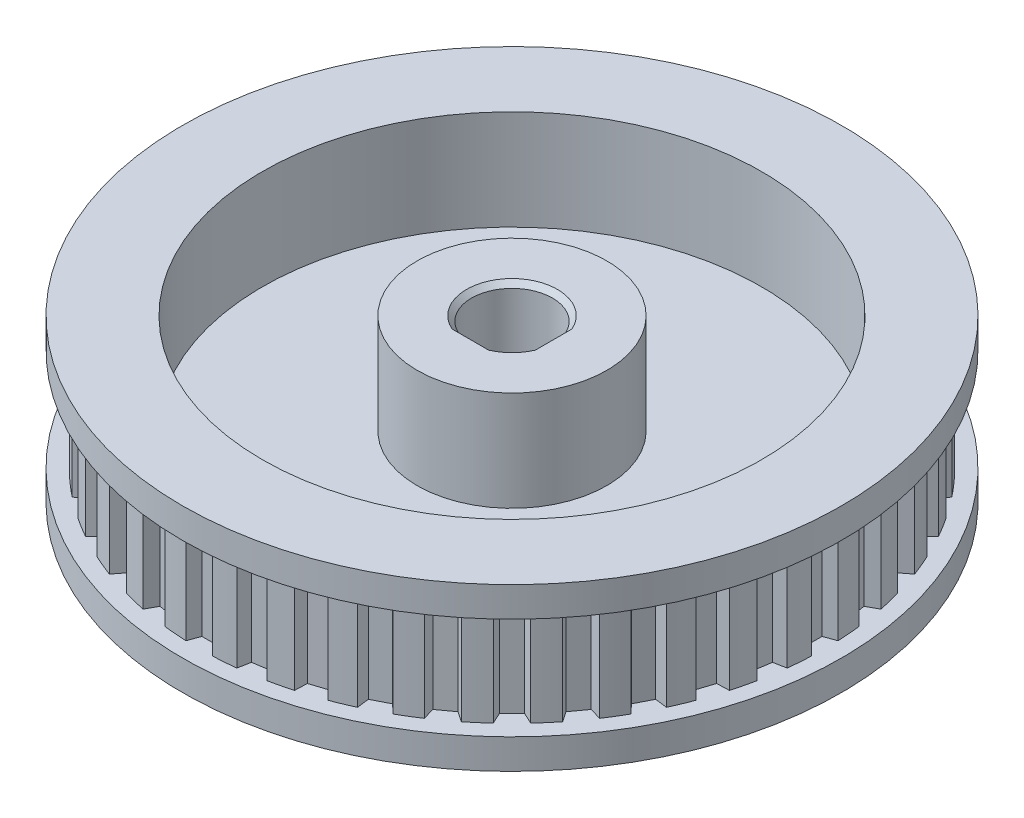
from build123d import *
from build123d.topology import SkipClean

# Parameters (mm, degrees)
EXTRUDE_1_DEPTH     = 10.2
SKETCH_2_R          = 33
EXTRUDE_2_DEPTH     = 3
EXTRUDE_START       = 3
SKETCH_3_R          = 33
EXTRUDE_3_DEPTH     = 3
SKETCH_4_R          = 25
SKETCH_4_R_2        = 9.5
CUT_EXTRUDE_4_DEPTH = 10
CUT_EXTRUDE_5_DEPTH = 10
CUT_EXTRUDE_START   = -6.2
SKETCH_6_R          = 4.05
CUT_EXTRUDE_6_DEPTH = 6.2
CHAMFER_1_SIZE      = 0.5
CHAMFER_2_SIZE      = 0.5


with BuildPart() as part:
    # Эскиз1 → Вытянуть1 (new body)
    with BuildSketch(Plane(origin=(0, 0, 0), x_dir=(1, 0, 0), z_dir=(0, 1, 0))):
        with BuildLine():
            Line((-0.9, 30.15), (0.9, 30.15))
            Line((0.9, 30.15), (1.326544618, 31.321921706))
            ThreePointArc((1.326544618, 31.321921706), (2.459692651, 31.253358413), (3.589615414, 31.143814172))
            Line((3.589615414, 31.143814172), (3.827579614, 29.919594487))
            Line((3.827579614, 29.919594487), (5.605418627, 29.63801245))
            Line((5.605418627, 29.63801245), (6.210040719, 30.728779577))
            ThreePointArc((6.210040719, 30.728779577), (7.318512157, 30.483797004), (8.417387201, 30.198842572))
            Line((8.417387201, 30.198842572), (8.460911516, 28.952469261))
            Line((8.460911516, 28.952469261), (10.172813245, 28.396238671))
            Line((10.172813245, 28.396238671), (10.940625007, 29.378992911))
            ThreePointArc((10.940625007, 29.378992911), (11.997125605, 28.963623344), (13.037894979, 28.510275244))
            Line((13.037894979, 28.510275244), (12.885907695, 27.272438154))
            Line((12.885907695, 27.272438154), (14.489719439, 26.455255255))
            Line((14.489719439, 26.455255255), (15.401814798, 27.305797936))
            ThreePointArc((15.401814798, 27.305797936), (16.380330004, 26.730269153), (17.337366513, 26.11969032))
            Line((17.337366513, 26.11969032), (16.993610062, 24.920869107))
            Line((16.993610062, 24.920869107), (18.449840652, 23.862855653))
            Line((18.449840652, 23.862855653), (19.483760792, 24.560243594))
            ThreePointArc((19.483760792, 24.560243594), (20.360196315, 23.838727022), (21.209934543, 23.085951933))
            Line((21.209934543, 23.085951933), (20.68287335, 21.955665556))
            Line((20.68287335, 21.955665556), (21.955665556, 20.68287335))
            Line((21.955665556, 20.68287335), (23.085951933, 21.209934543))
            ThreePointArc((23.085951933, 21.209934543), (23.838727022, 20.360196315), (24.560243594, 19.483760792))
            Line((24.560243594, 19.483760792), (23.862855653, 18.449840652))
            Line((23.862855653, 18.449840652), (24.920869107, 16.993610062))
            Line((24.920869107, 16.993610062), (26.11969032, 17.337366513))
            ThreePointArc((26.11969032, 17.337366513), (26.730269152, 16.380330004), (27.305797936, 15.401814798))
            Line((27.305797936, 15.401814798), (26.455255255, 14.489719439))
            Line((26.455255255, 14.489719439), (27.272438154, 12.885907695))
            Line((27.272438154, 12.885907695), (28.510275244, 13.037894979))
            ThreePointArc((28.510275244, 13.037894979), (28.963623344, 11.997125605), (29.378992911, 10.940625007))
            Line((29.378992911, 10.940625007), (28.396238671, 10.172813245))
            Line((28.396238671, 10.172813245), (28.952469261, 8.460911516))
            Line((28.952469261, 8.460911516), (30.198842572, 8.417387201))
            ThreePointArc((30.198842572, 8.417387201), (30.483797004, 7.318512157), (30.728779577, 6.210040719))
            Line((30.728779577, 6.210040719), (29.63801245, 5.605418628))
            Line((29.63801245, 5.605418628), (29.919594487, 3.827579614))
            Line((29.919594487, 3.827579614), (31.143814172, 3.589615414))
            ThreePointArc((31.143814172, 3.589615414), (31.253358413, 2.459692651), (31.321921706, 1.326544618))
            Line((31.321921706, 1.326544618), (30.15, 0.9))
            Line((30.15, 0.9), (30.15, -0.9))
            Line((30.15, -0.9), (31.321921706, -1.326544618))
            ThreePointArc((31.321921706, -1.326544618), (31.253358413, -2.459692651), (31.143814172, -3.589615414))
            Line((31.143814172, -3.589615414), (29.919594487, -3.827579614))
            Line((29.919594487, -3.827579614), (29.63801245, -5.605418627))
            Line((29.63801245, -5.605418627), (30.728779577, -6.210040719))
            ThreePointArc((30.728779577, -6.210040719), (30.483797004, -7.318512157), (30.198842572, -8.417387201))
            Line((30.198842572, -8.417387201), (28.952469261, -8.460911516))
            Line((28.952469261, -8.460911516), (28.396238671, -10.172813245))
            Line((28.396238671, -10.172813245), (29.378992911, -10.940625007))
            ThreePointArc((29.378992911, -10.940625007), (28.963623344, -11.997125605), (28.510275244, -13.037894979))
            Line((28.510275244, -13.037894979), (27.272438154, -12.885907695))
            Line((27.272438154, -12.885907695), (26.455255255, -14.489719439))
            Line((26.455255255, -14.489719439), (27.305797936, -15.401814798))
            ThreePointArc((27.305797936, -15.401814798), (26.730269152, -16.380330004), (26.11969032, -17.337366513))
            Line((26.11969032, -17.337366513), (24.920869107, -16.993610062))
            Line((24.920869107, -16.993610062), (23.862855653, -18.449840652))
            Line((23.862855653, -18.449840652), (24.560243594, -19.483760792))
            ThreePointArc((24.560243594, -19.483760792), (23.838727022, -20.360196315), (23.085951933, -21.209934543))
            Line((23.085951933, -21.209934543), (21.955665556, -20.68287335))
            Line((21.955665556, -20.68287335), (20.68287335, -21.955665556))
            Line((20.68287335, -21.955665556), (21.209934543, -23.085951933))
            ThreePointArc((21.209934543, -23.085951933), (20.360196315, -23.838727022), (19.483760792, -24.560243594))
            Line((19.483760792, -24.560243594), (18.449840652, -23.862855653))
            Line((18.449840652, -23.862855653), (16.993610062, -24.920869107))
            Line((16.993610062, -24.920869107), (17.337366513, -26.11969032))
            ThreePointArc((17.337366513, -26.11969032), (16.380330004, -26.730269152), (15.401814798, -27.305797936))
            Line((15.401814798, -27.305797936), (14.489719439, -26.455255255))
            Line((14.489719439, -26.455255255), (12.885907695, -27.272438154))
            Line((12.885907695, -27.272438154), (13.037894979, -28.510275244))
            ThreePointArc((13.037894979, -28.510275244), (11.997125605, -28.963623344), (10.940625007, -29.378992911))
            Line((10.940625007, -29.378992911), (10.172813245, -28.396238671))
            Line((10.172813245, -28.396238671), (8.460911516, -28.952469261))
            Line((8.460911516, -28.952469261), (8.417387201, -30.198842572))
            ThreePointArc((8.417387201, -30.198842572), (7.318512157, -30.483797004), (6.210040719, -30.728779577))
            Line((6.210040719, -30.728779577), (5.605418627, -29.63801245))
            Line((5.605418627, -29.63801245), (3.827579614, -29.919594487))
            Line((3.827579614, -29.919594487), (3.589615414, -31.143814172))
            ThreePointArc((3.589615414, -31.143814172), (2.459692651, -31.253358413), (1.326544618, -31.321921706))
            Line((1.326544618, -31.321921706), (0.9, -30.15))
            Line((0.9, -30.15), (-0.9, -30.15))
            Line((-0.9, -30.15), (-1.326544618, -31.321921706))
            ThreePointArc((-1.326544618, -31.321921706), (-2.459692651, -31.253358413), (-3.589615414, -31.143814172))
            Line((-3.589615414, -31.143814172), (-3.827579614, -29.919594487))
            Line((-3.827579614, -29.919594487), (-5.605418627, -29.63801245))
            Line((-5.605418627, -29.63801245), (-6.210040719, -30.728779577))
            ThreePointArc((-6.210040719, -30.728779577), (-7.318512157, -30.483797004), (-8.417387201, -30.198842572))
            Line((-8.417387201, -30.198842572), (-8.460911516, -28.952469261))
            Line((-8.460911516, -28.952469261), (-10.172813245, -28.396238671))
            Line((-10.172813245, -28.396238671), (-10.940625007, -29.378992911))
            ThreePointArc((-10.940625007, -29.378992911), (-11.997125605, -28.963623344), (-13.037894979, -28.510275244))
            Line((-13.037894979, -28.510275244), (-12.885907695, -27.272438154))
            Line((-12.885907695, -27.272438154), (-14.489719439, -26.455255255))
            Line((-14.489719439, -26.455255255), (-15.401814798, -27.305797936))
            ThreePointArc((-15.401814798, -27.305797936), (-16.380330004, -26.730269152), (-17.337366513, -26.11969032))
            Line((-17.337366513, -26.11969032), (-16.993610062, -24.920869107))
            Line((-16.993610062, -24.920869107), (-18.449840652, -23.862855653))
            Line((-18.449840652, -23.862855653), (-19.483760792, -24.560243594))
            ThreePointArc((-19.483760792, -24.560243594), (-20.360196315, -23.838727022), (-21.209934543, -23.085951933))
            Line((-21.209934543, -23.085951933), (-20.68287335, -21.955665556))
            Line((-20.68287335, -21.955665556), (-21.955665556, -20.68287335))
            Line((-21.955665556, -20.68287335), (-23.085951933, -21.209934543))
            ThreePointArc((-23.085951933, -21.209934543), (-23.838727022, -20.360196315), (-24.560243594, -19.483760792))
            Line((-24.560243594, -19.483760792), (-23.862855653, -18.449840652))
            Line((-23.862855653, -18.449840652), (-24.920869107, -16.993610062))
            Line((-24.920869107, -16.993610062), (-26.11969032, -17.337366513))
            ThreePointArc((-26.11969032, -17.337366513), (-26.730269152, -16.380330004), (-27.305797936, -15.401814798))
            Line((-27.305797936, -15.401814798), (-26.455255255, -14.489719439))
            Line((-26.455255255, -14.489719439), (-27.272438154, -12.885907695))
            Line((-27.272438154, -12.885907695), (-28.510275244, -13.037894979))
            ThreePointArc((-28.510275244, -13.037894979), (-28.963623344, -11.997125605), (-29.378992911, -10.940625007))
            Line((-29.378992911, -10.940625007), (-28.396238671, -10.172813245))
            Line((-28.396238671, -10.172813245), (-28.952469261, -8.460911516))
            Line((-28.952469261, -8.460911516), (-30.198842572, -8.417387201))
            ThreePointArc((-30.198842572, -8.417387201), (-30.483797004, -7.318512157), (-30.728779577, -6.210040719))
            Line((-30.728779577, -6.210040719), (-29.63801245, -5.605418627))
            Line((-29.63801245, -5.605418627), (-29.919594487, -3.827579614))
            Line((-29.919594487, -3.827579614), (-31.143814172, -3.589615414))
            ThreePointArc((-31.143814172, -3.589615414), (-31.253358413, -2.459692651), (-31.321921706, -1.326544618))
            Line((-31.321921706, -1.326544618), (-30.15, -0.9))
            Line((-30.15, -0.9), (-30.15, 0.9))
            Line((-30.15, 0.9), (-31.321921706, 1.326544618))
            ThreePointArc((-31.321921706, 1.326544618), (-31.253358413, 2.459692651), (-31.143814172, 3.589615414))
            Line((-31.143814172, 3.589615414), (-29.919594487, 3.827579614))
            Line((-29.919594487, 3.827579614), (-29.63801245, 5.605418628))
            Line((-29.63801245, 5.605418628), (-30.728779577, 6.210040719))
            ThreePointArc((-30.728779577, 6.210040719), (-30.483797004, 7.318512157), (-30.198842572, 8.417387201))
            Line((-30.198842572, 8.417387201), (-28.952469261, 8.460911516))
            Line((-28.952469261, 8.460911516), (-28.396238671, 10.172813245))
            Line((-28.396238671, 10.172813245), (-29.378992911, 10.940625007))
            ThreePointArc((-29.378992911, 10.940625007), (-28.963623344, 11.997125605), (-28.510275244, 13.037894979))
            Line((-28.510275244, 13.037894979), (-27.272438154, 12.885907695))
            Line((-27.272438154, 12.885907695), (-26.455255255, 14.489719439))
            Line((-26.455255255, 14.489719439), (-27.305797936, 15.401814798))
            ThreePointArc((-27.305797936, 15.401814798), (-26.730269152, 16.380330004), (-26.11969032, 17.337366513))
            Line((-26.11969032, 17.337366513), (-24.920869107, 16.993610062))
            Line((-24.920869107, 16.993610062), (-23.862855653, 18.449840652))
            Line((-23.862855653, 18.449840652), (-24.560243594, 19.483760792))
            ThreePointArc((-24.560243594, 19.483760792), (-23.838727022, 20.360196315), (-23.085951933, 21.209934543))
            Line((-23.085951933, 21.209934543), (-21.955665556, 20.68287335))
            Line((-21.955665556, 20.68287335), (-20.68287335, 21.955665556))
            Line((-20.68287335, 21.955665556), (-21.209934543, 23.085951933))
            ThreePointArc((-21.209934543, 23.085951933), (-20.360196315, 23.838727022), (-19.483760792, 24.560243594))
            Line((-19.483760792, 24.560243594), (-18.449840652, 23.862855653))
            Line((-18.449840652, 23.862855653), (-16.993610062, 24.920869107))
            Line((-16.993610062, 24.920869107), (-17.337366513, 26.11969032))
            ThreePointArc((-17.337366513, 26.11969032), (-16.380330004, 26.730269153), (-15.401814798, 27.305797936))
            Line((-15.401814798, 27.305797936), (-14.489719439, 26.455255255))
            Line((-14.489719439, 26.455255255), (-12.885907695, 27.272438154))
            Line((-12.885907695, 27.272438154), (-13.037894979, 28.510275244))
            ThreePointArc((-13.037894979, 28.510275244), (-11.997125605, 28.963623344), (-10.940625007, 29.378992911))
            Line((-10.940625007, 29.378992911), (-10.172813245, 28.396238671))
            Line((-10.172813245, 28.396238671), (-8.460911516, 28.952469261))
            Line((-8.460911516, 28.952469261), (-8.417387201, 30.198842572))
            ThreePointArc((-8.417387201, 30.198842572), (-7.318512157, 30.483797004), (-6.210040719, 30.728779577))
            Line((-6.210040719, 30.728779577), (-5.605418627, 29.63801245))
            Line((-5.605418627, 29.63801245), (-3.827579614, 29.919594487))
            Line((-3.827579614, 29.919594487), (-3.589615414, 31.143814172))
            ThreePointArc((-3.589615414, 31.143814172), (-2.459692651, 31.253358413), (-1.326544618, 31.321921706))
            Line((-1.326544618, 31.321921706), (-0.9, 30.15))
        make_face()
    extrude(amount=EXTRUDE_1_DEPTH)

    # Эскиз2 → Вытянуть2 (add)
    with BuildSketch(Plane(origin=(0, 10.2, 0), x_dir=(1, 0, 0), z_dir=(0, 1, 0))):
        with Locations(Location((0, 0, 0), (0, 0, 270))):
            Circle(SKETCH_2_R)
    extrude(amount=EXTRUDE_2_DEPTH)

    # Эскиз3 → Вытянуть3 (add)
    with BuildSketch(Plane.XZ.offset(EXTRUDE_START)):
        with Locations(Location((0, 0, 0), (0, 0, 90))):
            Circle(SKETCH_3_R)
    extrude(amount=-EXTRUDE_3_DEPTH)

    # Эскиз4 → Вытянуть4 (cut)
    with BuildSketch(Plane(origin=(0, 13.2, 0), x_dir=(1, 0, 0), z_dir=(0, 1, 0))):
        with Locations(Location((0, 0, 0), (0, 0, 270))):
            Circle(SKETCH_4_R)
        with Locations(Location((0, 0, 0), (0, 0, 270))):
            Circle(SKETCH_4_R_2, mode=Mode.SUBTRACT)
    extrude(amount=-CUT_EXTRUDE_4_DEPTH, mode=Mode.SUBTRACT)

    # Эскиз5 → Вытянуть5 (cut)
    with BuildSketch(Plane(origin=(0, 13.2, 0), x_dir=(1, 0, 0), z_dir=(0, 1, 0))):
        with BuildLine():
            Line((3.66427005, 1.725), (3.66427005, -1.725))
            ThreePointArc((3.66427005, -1.725), (2.863782464, -2.863782464), (1.725, -3.66427005))
            Line((1.725, -3.66427005), (-1.725, -3.66427005))
            ThreePointArc((-1.725, -3.66427005), (-2.863782464, 2.863782464), (3.66427005, 1.725))
        make_face()
    extrude(amount=-CUT_EXTRUDE_5_DEPTH, mode=Mode.SUBTRACT)

    # Эскиз6 → Вытянуть6 (cut)
    with SkipClean():  # the faces are left unmerged after this step: merging them gives an invalid solid
        with BuildSketch(Plane.XZ.offset(3).offset(CUT_EXTRUDE_START)):
            with Locations(Location((0, 0, 0), (0, 0, 64.790714413))):
                Circle(SKETCH_6_R)
        extrude(amount=CUT_EXTRUDE_6_DEPTH, mode=Mode.SUBTRACT)

    # Фаска1
    chamfer_1_edges = [part.edges().sort_by_distance(p)[0] for p in [
        (-1.725, -3, -3.66427005),
    ]]
    chamfer(chamfer_1_edges, length=CHAMFER_1_SIZE)

    # Фаска2
    chamfer_2_edges = [part.edges().sort_by_distance(p)[0] for p in [
        (-2.863782464, 13.2, -2.863782464),
        (0, 13.2, 3.66427005),
        (2.863782464, 13.2, 2.863782464),
        (3.66427005, 13.2, 0),
    ]]
    chamfer(chamfer_2_edges, length=CHAMFER_2_SIZE)


solid = part.part
